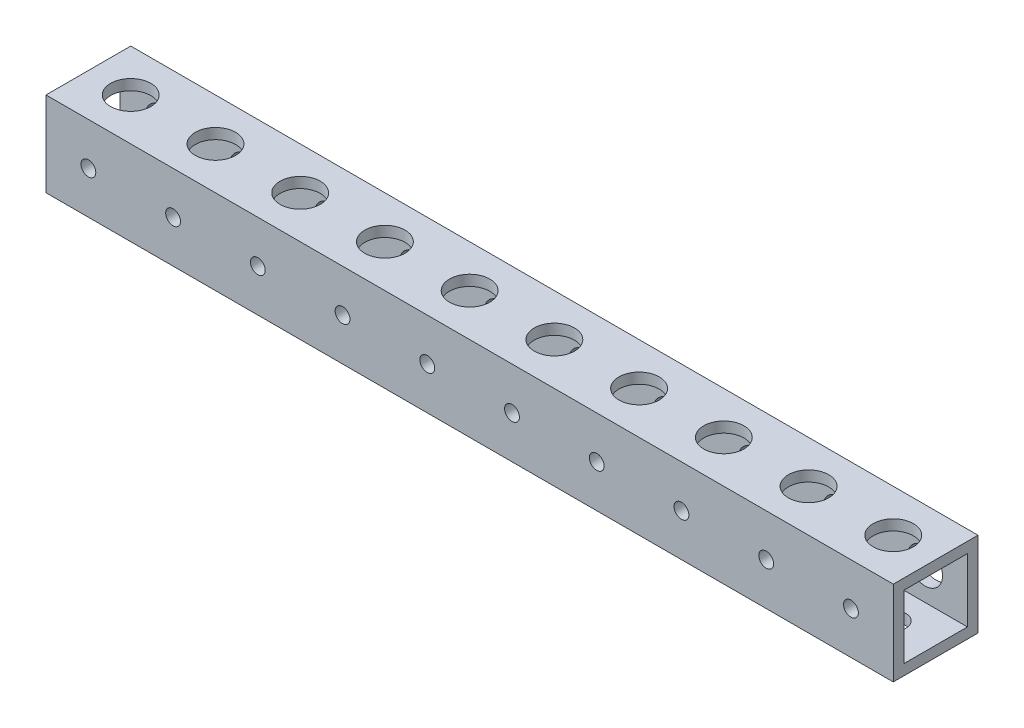
from build123d import *

# Parameters (mm, degrees)
SKETCH2_W           = 25.4
SKETCH2_H           = 25.4
SKETCH2_W_2         = 19.05
SKETCH2_H_2         = 19.05
BOSS_EXTRUDE1_DEPTH = 254
SKETCH3_R           = 6.0325
CUT_EXTRUDE1_DEPTH  = 3.175
SKETCH4_R           = 3.81
CUT_EXTRUDE2_DEPTH  = 3.175
LPATTERN1_COUNT     = 10
LPATTERN1_PITCH     = 25.4
SKETCH6_R           = 2.2225
CUT_EXTRUDE3_DEPTH  = 3.175
SKETCH7_R           = 5.23875
CUT_EXTRUDE4_DEPTH  = 3.175
LPATTERN2_COUNT     = 10
LPATTERN2_PITCH     = 25.4


with BuildPart() as part:
    # Sketch2 → Boss-Extrude1 (new body)
    with BuildSketch(Plane(origin=(0, 0, 0), x_dir=(0, 0, -1), z_dir=(1, 0, 0))):
        Rectangle(SKETCH2_W, SKETCH2_H)
        Rectangle(SKETCH2_W_2, SKETCH2_H_2, mode=Mode.SUBTRACT)
    extrude(amount=BOSS_EXTRUDE1_DEPTH)

    # Sketch3 → Cut-Extrude1 (cut)
    with BuildSketch(Plane(origin=(0, 12.7, 0), x_dir=(1, 0, 0), z_dir=(0, 1, 0))):
        with Locations(Location((12.7, 0, 0), (0, 0, 270))):
            Circle(SKETCH3_R)
    cut_extrude1 = extrude(amount=-CUT_EXTRUDE1_DEPTH, mode=Mode.SUBTRACT)

    # Sketch4 → Cut-Extrude2 (cut)
    with BuildSketch(Plane.XZ.offset(12.7)):
        with Locations(Location((12.7, 0, 0), (0, 0, 270))):
            Circle(SKETCH4_R)
    cut_extrude2 = extrude(amount=-CUT_EXTRUDE2_DEPTH, mode=Mode.SUBTRACT)

    # LPattern1: Cut-Extrude1, Cut-Extrude2 ×10
    with Locations(*[(i * LPATTERN1_PITCH, 0, 0) for i in range(1, LPATTERN1_COUNT)]):
        add(cut_extrude1, mode=Mode.SUBTRACT)
        add(cut_extrude2, mode=Mode.SUBTRACT)

    # Sketch6 → Cut-Extrude3 (cut)
    with BuildSketch(Plane.XY.offset(12.7)):
        with Locations((12.7, 0)):
            Circle(SKETCH6_R)
    cut_extrude3 = extrude(amount=-CUT_EXTRUDE3_DEPTH, mode=Mode.SUBTRACT)

    # Sketch7 → Cut-Extrude4 (cut)
    with BuildSketch(Plane(origin=(0, 0, -12.7), x_dir=(-1, 0, 0), z_dir=(0, 0, -1))):
        with Locations((-12.7, 0)):
            Circle(SKETCH7_R)
    cut_extrude4 = extrude(amount=-CUT_EXTRUDE4_DEPTH, mode=Mode.SUBTRACT)

    # LPattern2: Cut-Extrude3, Cut-Extrude4 ×10
    with Locations(*[(i * LPATTERN2_PITCH, 0, 0) for i in range(1, LPATTERN2_COUNT)]):
        add(cut_extrude3, mode=Mode.SUBTRACT)
        add(cut_extrude4, mode=Mode.SUBTRACT)


solid = part.part
